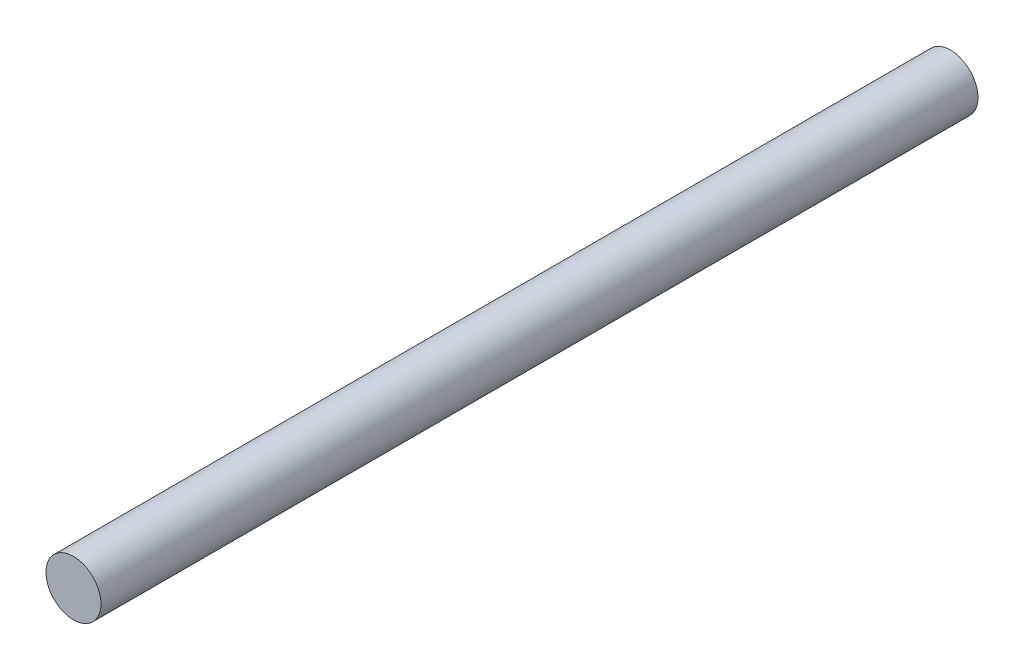
from build123d import *

# Parameters (mm, degrees)
SKETCH1_R           = 2.5
BOSS_EXTRUDE1_DEPTH = 79.72


with BuildPart() as part:
    # Sketch1 → Boss-Extrude1 (new body)
    with BuildSketch(Plane.XY):
        Circle(SKETCH1_R)
    extrude(amount=BOSS_EXTRUDE1_DEPTH)


solid = part.part
